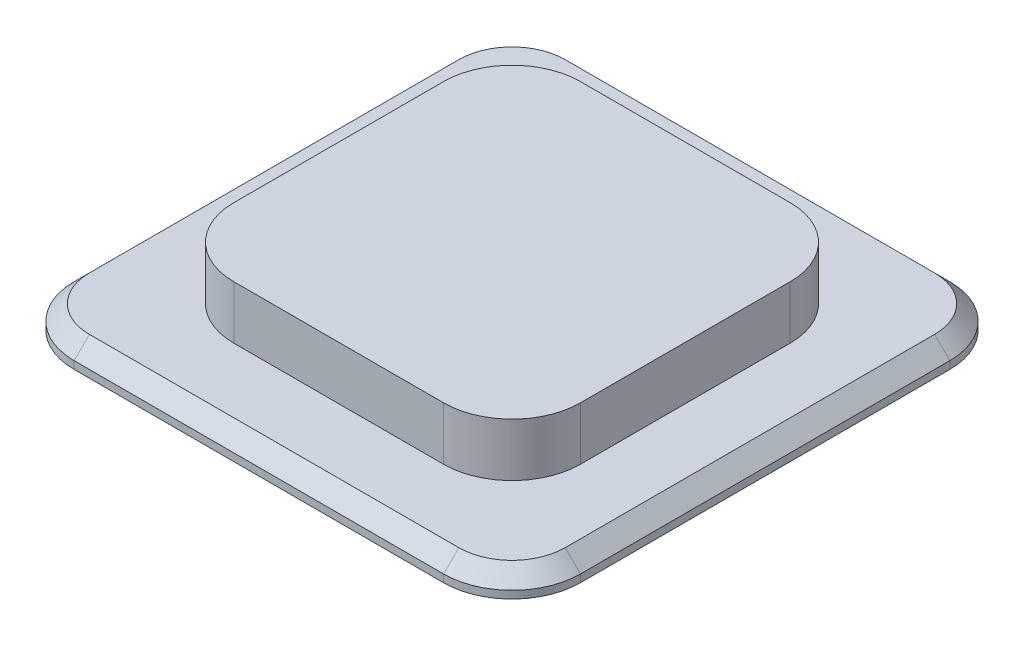
from build123d import *

# Parameters (mm, degrees)
SKETCH1_W           = 33.3
SKETCH1_H           = 33.3
BOSS_EXTRUDE1_DEPTH = 1.5
SKETCH1_3_W         = 22.8
SKETCH1_3_H         = 22.8
BOSS_EXTRUDE2_DEPTH = 5
FILLET1_R           = 4.5
CHAMFER1_SIZE       = 1


with BuildPart() as part:
    # Sketch1 → Boss-Extrude1 (new body)
    with BuildSketch(Plane(origin=(0, 0, 0), x_dir=(1, 0, 0), z_dir=(0, 1, 0))):
        Rectangle(SKETCH1_W, SKETCH1_H)
    extrude(amount=BOSS_EXTRUDE1_DEPTH)

    # Sketch1<3> → Boss-Extrude2 (add)
    with BuildSketch(Plane(origin=(0, 0, 0), x_dir=(1, 0, 0), z_dir=(0, 1, 0))):
        Rectangle(SKETCH1_3_W, SKETCH1_3_H)
    extrude(amount=BOSS_EXTRUDE2_DEPTH)

    # Fillet1
    fillet1_edges = [part.edges().sort_by_distance(p)[0] for p in [
        (16.65, 0.75, 16.65),
        (11.4, 3.25, 11.4),
        (11.4, 3.25, -11.4),
        (16.65, 0.75, -16.65),
        (-16.65, 0.75, -16.65),
        (-11.4, 3.25, -11.4),
        (-11.4, 3.25, 11.4),
        (-16.65, 0.75, 16.65),
    ]]
    fillet(fillet1_edges, radius=FILLET1_R)

    # Chamfer1
    chamfer1_edges = [part.edges().sort_by_distance(p)[0] for p in [
        (15.331980515, 1.5, -15.331980515),
        (16.65, 1.5, 0),
        (15.331980515, 1.5, 15.331980515),
        (0, 1.5, 16.65),
        (-15.331980515, 1.5, 15.331980515),
        (-16.65, 1.5, 0),
        (-15.331980515, 1.5, -15.331980515),
        (0, 1.5, -16.65),
    ]]
    chamfer(chamfer1_edges, length=CHAMFER1_SIZE)


solid = part.part
